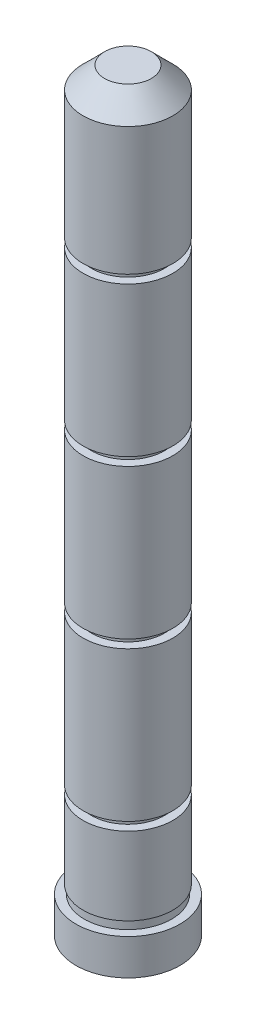
from build123d import *

# Parameters (mm, degrees)
CHAMFER1_SIZE = 6


with BuildPart() as part:
    # Sketch1 → Revolve1 (revolve)
    with BuildSketch(Plane.XY, mode=Mode.PRIVATE) as revolve1_sk:
        Polygon((0, 0), (14.5, 0), (14.5, 10), (12.15, 10), (12.15, 12.35), (12.5, 12.35), (12.5, 34), (10.15, 34), (10.15, 36.35), (12.5, 36.35), (12.5, 78), (10.15, 78), (10.15, 80.35), (12.5, 80.35), (12.5, 122), (10.15, 122), (10.15, 124.35), (12.5, 124.35), (12.5, 166), (10.15, 166), (10.15, 168.35), (12.5, 168.35), (12.5, 210), (0, 210), align=None)
    revolve(revolve1_sk.sketch.rotate(Axis((0, 210, 0), (0, -1, 0)), 180), axis=Axis((0, 210, 0), (0, -1, 0)))

    # Chamfer1
    chamfer1_edges = [part.edges().sort_by_distance(p)[0] for p in [
        (12.5, 210, 0),
    ]]
    chamfer(chamfer1_edges, length=CHAMFER1_SIZE)


solid = part.part
